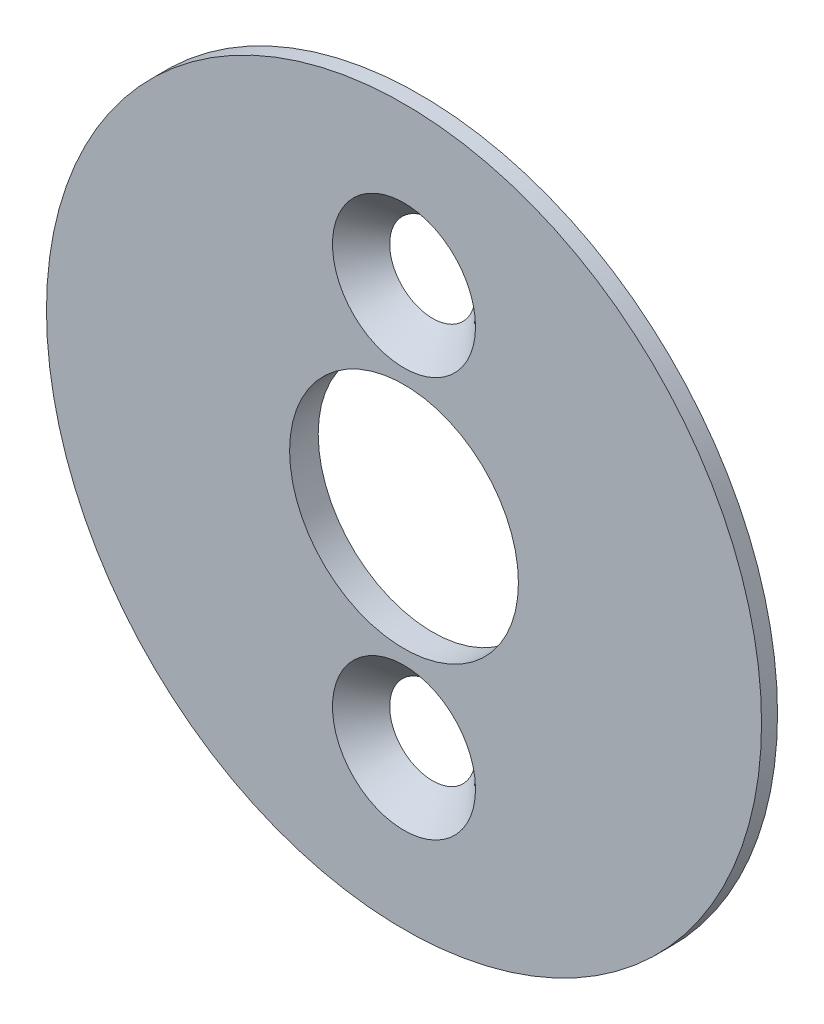
from build123d import *

# Parameters (mm, degrees)
SKETCH1_R                                    = 12.5
BOSS_EXTRUDE1_DEPTH                          = 1
CUT_EXTRUDE1_REACH                           = 19.706
SKETCH3_R                                    = 4
CSK_FOR_M3_FLAT_COUNTERSUNK_HEAD_SCR_2_COUNT = 2
CSK_FOR_M3_FLAT_COUNTERSUNK_HEAD_SCR_2_PITCH = 14


with BuildPart() as part:
    # Sketch1 → Boss-Extrude1 (new body)
    with BuildSketch(Plane.XY):
        Circle(SKETCH1_R)
    extrude(amount=BOSS_EXTRUDE1_DEPTH)

    # Sketch2 → Cut-Revolve1 (revolve, cut)
    with BuildSketch(Plane(origin=(0, 0, 2), x_dir=(0, 0, 1), z_dir=(-1, 0, 0)), mode=Mode.PRIVATE) as cut_revolve1_sk:
        Polygon((-2, 10), (-1.530086733, 12.665010569), (-2, 12.665010386), align=None)
    revolve(cut_revolve1_sk.sketch.rotate(Axis((0, 0, -0.1), (0, 0, 1)), 270), axis=Axis((0, 0, -0.1), (0, 0, 1)), mode=Mode.SUBTRACT)

    # Sketch3 → Cut-Extrude1 (cut, up to next)
    with BuildSketch(Plane(origin=(0, 0, 0), x_dir=(-1, 0, 0), z_dir=(0, 0, -1)), mode=Mode.PRIVATE) as cut_extrude1_sk1:
        Circle(SKETCH3_R)
    cut_extrude1_tool1 = extrude(cut_extrude1_sk1.sketch, amount=-CUT_EXTRUDE1_REACH, mode=Mode.PRIVATE) & part.part
    add(cut_extrude1_tool1.solids().sort_by_distance((0, 0, 0))[0], mode=Mode.SUBTRACT)

    # Sketch5 → CSK for M3 Flat Countersunk Head Screw1 (revolve, cut)
    with BuildSketch(Plane(origin=(0, 7, 1), x_dir=(0, -1, 0), z_dir=(1, 0, 0))):
        Polygon((0, 0), (0, 1), (1.35, 1), (1.35, 1.15), (2.5, 0), align=None)
    csk_for_m3_flat_countersunk_head_screw1 = revolve(axis=Axis((0, 7, 7.35), (0, 0, -1)), mode=Mode.SUBTRACT)

    # CSK for M3 Flat Countersunk Head Scr 2: CSK for M3 Flat Countersunk Head Screw1 ×2
    with Locations(*[(0, -i * CSK_FOR_M3_FLAT_COUNTERSUNK_HEAD_SCR_2_PITCH, 0) for i in range(1, CSK_FOR_M3_FLAT_COUNTERSUNK_HEAD_SCR_2_COUNT)]):
        add(csk_for_m3_flat_countersunk_head_screw1, mode=Mode.SUBTRACT)


solid = part.part
